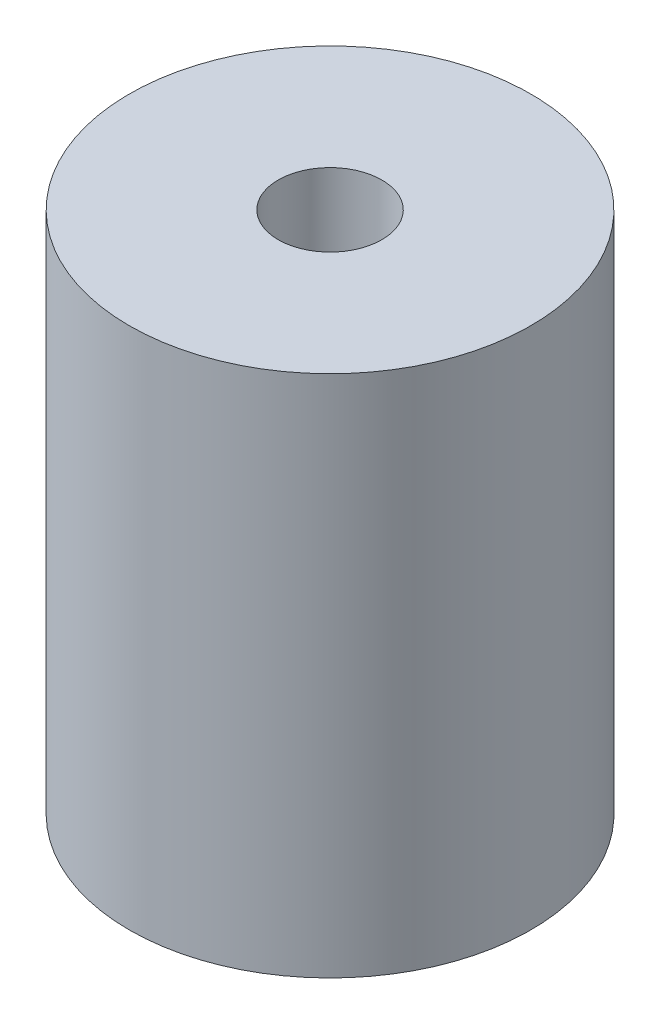
from build123d import *

# Parameters (mm, degrees)
SKETCH1_R           = 9.475
BOSS_EXTRUDE1_DEPTH = 12.35
SKETCH2_R           = 2.445
CUT_EXTRUDE1_DEPTH  = 10
SKETCH3_R           = 3.925
CUT_EXTRUDE2_DEPTH  = 19


with BuildPart() as part:
    # Sketch1 → Boss-Extrude1 (new, symmetric)
    with BuildSketch(Plane(origin=(0, 0, 0), x_dir=(1, 0, 0), z_dir=(0, 1, 0))):
        with Locations(Location((0, 0, 0), (0, 0, 270))):
            Circle(SKETCH1_R)
    extrude(amount=BOSS_EXTRUDE1_DEPTH, both=True)

    # Sketch2 → Cut-Extrude1 (cut)
    with BuildSketch(Plane(origin=(0, 12.35, 0), x_dir=(1, 0, 0), z_dir=(0, 1, 0))):
        with Locations(Location((0, 0, 0), (0, 0, 270))):
            Circle(SKETCH2_R)
    extrude(amount=-CUT_EXTRUDE1_DEPTH, mode=Mode.SUBTRACT)

    # Sketch3 → Cut-Extrude2 (cut)
    with BuildSketch(Plane.XZ.offset(12.35)):
        with Locations(Location((0, 0, 0), (0, 0, 270))):
            Circle(SKETCH3_R)
    extrude(amount=-CUT_EXTRUDE2_DEPTH, mode=Mode.SUBTRACT)


solid = part.part
